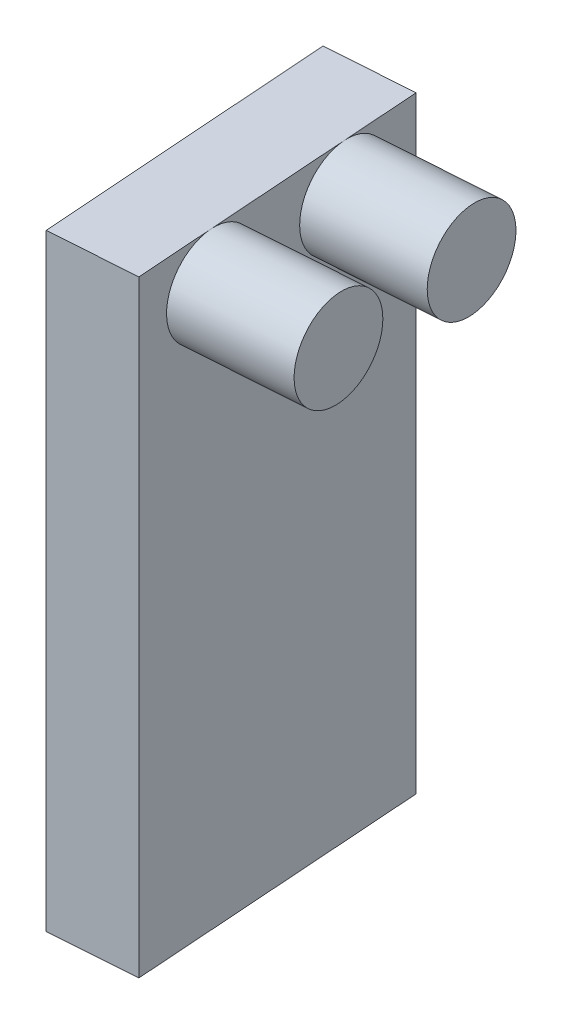
from build123d import *

# Parameters (mm, degrees)
BOSS_EXTRUDE1_DEPTH = 25.4
BOSS_EXTRUDE2_DEPTH = 25.4
SKETCH3_R           = 2
BOSS_EXTRUDE3_DEPTH = 5


with BuildPart() as part:
    # Sketch1 → Boss-Extrude1 (new body)
    with BuildSketch(Plane(origin=(0, 0, 0), x_dir=(1, 0, 0), z_dir=(0, 1, 0))):
        Polygon((83.176569024, -44.663089882), (25.185203896, -48.709261314), (-35.715075295, 41.609133969), (-10.223479979, 93.854215086), (98.44468436, 101.436206322), (130.944454172, 53.237296637), align=None)
        Polygon((28.400509379, -42.119485598), (-28.400509379, 42.119485598), (-6.124219546, 87.774790999), (95.229378877, 94.846430606), (123.629888256, 52.726945008), (79.07730859, -38.583665795), align=None, mode=Mode.SUBTRACT)
    extrude(amount=BOSS_EXTRUDE1_DEPTH)

    # Sketch2 → Boss-Extrude2 (add)
    with BuildSketch(Plane(origin=(0, 25.4, 0), x_dir=(1, 0, 0), z_dir=(0, 1, 0))):
        Polygon((123.193813482, 58.976945008), (124.063847882, 46.507260162), (131.411983768, 47.019954034), (130.541949367, 59.489638879), align=None)
    extrude(amount=-BOSS_EXTRUDE2_DEPTH)

    # Sketch3 → Boss-Extrude3 (add)
    with BuildSketch(Plane(origin=(134.040133914, 0, -9.35224338), x_dir=(-0.06960275203236939, 0, -0.9975747876272337), z_dir=(0.9975747876272337, 0, -0.06960275203236939))):
        with Locations(Location((41.009284939, 23.4, 0), (0, 0, 90))):
            Circle(SKETCH3_R)
        with Locations(Location((47.009284939, 23.4, 0), (0, 0, 180))):
            Circle(SKETCH3_R)
    extrude(amount=BOSS_EXTRUDE3_DEPTH)

    # SurfaceCut1
    split(bisect_by=Plane(origin=(130.455463613, 0, -9.286150729), x_dir=(-0.07100287910742022, 0, -0.9974761105703019), z_dir=(0.9974761105703019, 0, -0.07100287910742022)), keep=Keep.TOP)


solid = part.part
